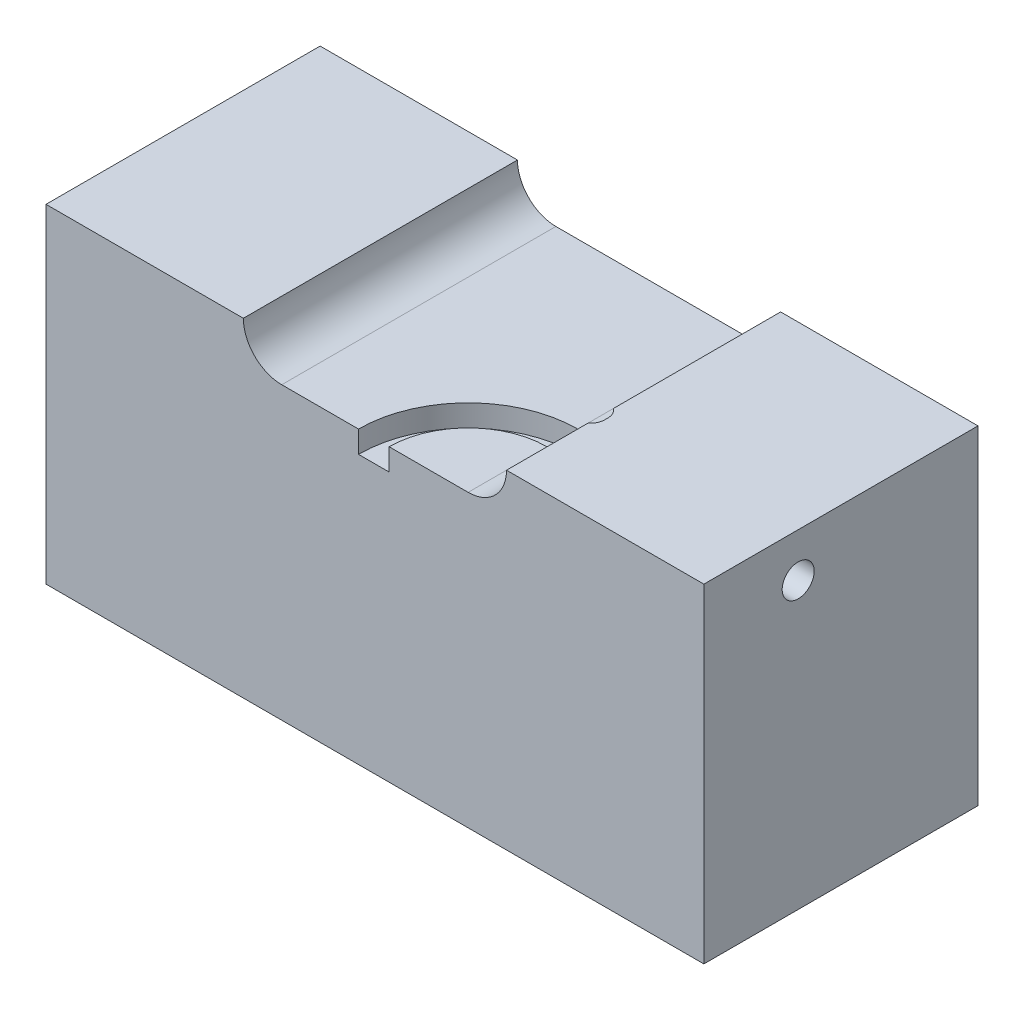
from build123d import *

# Parameters (mm, degrees)
SKETCH1_W               = 38.1
SKETCH1_H               = 15.875
BOSS_EXTRUDE1_DEPTH     = 19.05
CUT_EXTRUDE1_DEPTH      = 25.4
CUT_EXTRUDE2_DEPTH      = 27.62839016
CUT_EXTRUDE2_DEPTH_BACK = 1.27
SKETCH5_R               = 0.9271
CUT_EXTRUDE3_DEPTH      = 12.7


with BuildPart() as part:
    # Sketch1 → Boss-Extrude1 (new body)
    with BuildSketch(Plane(origin=(0, 0, 0), x_dir=(1, 0, 0), z_dir=(0, 1, 0))):
        Rectangle(SKETCH1_W, SKETCH1_H)
    extrude(amount=BOSS_EXTRUDE1_DEPTH)

    # Sketch2 → Cut-Extrude1 (cut)
    with BuildSketch(Plane(origin=(0, 0, -7.9375), x_dir=(-1, 0, 0), z_dir=(0, 0, -1))):
        with BuildLine():
            Line((5.3975, 16.8275), (-5.3975, 16.8275))
            ThreePointArc((-5.3975, 16.8275), (-7.62, 19.05), (-5.3975, 21.2725))
            Line((-5.3975, 21.2725), (5.3975, 21.2725))
            ThreePointArc((5.3975, 21.2725), (7.62, 19.05), (5.3975, 16.8275))
        make_face()
    extrude(amount=-CUT_EXTRUDE1_DEPTH, mode=Mode.SUBTRACT)

    # Sketch4 → Cut-Extrude2 (cut, two sides: drawn at the far end of the back side and taken through both)
    with BuildSketch(Plane(origin=(0, 16.8275, 0), x_dir=(1, 0, 0), z_dir=(0, 1, 0)).offset(-CUT_EXTRUDE2_DEPTH_BACK)):
        with BuildLine():
            Line((0.8255, -7.9375), (-0.9525, -7.9375))
            ThreePointArc((-0.9525, -7.9375), (0.907371939, -3.447371939), (5.3975, -1.5875))
            Line((5.3975, -1.5875), (7.14375, -1.5875))
            ThreePointArc((7.14375, -1.5875), (7.705016008, -1.819983992), (7.9375, -2.38125))
            Line((7.9375, -2.38125), (7.9375, -2.57175))
            ThreePointArc((7.9375, -2.57175), (7.705016008, -3.133016008), (7.14375, -3.3655))
            Line((7.14375, -3.3655), (5.3975, -3.3655))
            ThreePointArc((5.3975, -3.3655), (2.164607796, -4.704607796), (0.8255, -7.9375))
        make_face()
    extrude(amount=CUT_EXTRUDE2_DEPTH + CUT_EXTRUDE2_DEPTH_BACK, mode=Mode.SUBTRACT)

    # Sketch5 → Cut-Extrude3 (cut)
    with BuildSketch(Plane(origin=(19.05, 0, 0), x_dir=(0, 0, -1), z_dir=(1, 0, 0))):
        with Locations((-2.4765, 16.51)):
            Circle(SKETCH5_R)
    extrude(amount=-CUT_EXTRUDE3_DEPTH, mode=Mode.SUBTRACT)


solid = part.part
